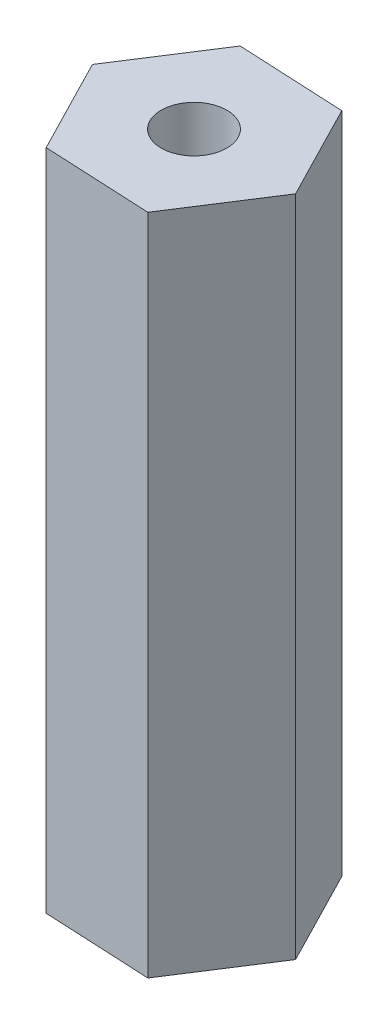
from build123d import *

# Parameters (mm, degrees)
BOSS_EXTRUDE1_DEPTH = 22.20000005
SKETCH2_R           = 1.1
CUT_EXTRUDE1_DEPTH  = 23.710319017


with BuildPart() as part:
    # Sketch1 → Boss-Extrude1 (new body)
    with BuildSketch(Plane(origin=(0, 0, 0), x_dir=(1, 0, 0), z_dir=(0, 1, 0))):
        Polygon((-1.636320259, 3.183675446), (-3.575303943, 0.17474281), (-1.938983684, -3.008932636), (1.636320259, -3.183675446), (3.575303943, -0.17474281), (1.938983684, 3.008932636), align=None)
    extrude(amount=BOSS_EXTRUDE1_DEPTH)

    # Sketch2 → Cut-Extrude1 (cut, through all)
    with BuildSketch(Plane.XZ):
        with Locations(Location((0, 0, 0), (0, 0, 270))):
            Circle(SKETCH2_R)
    extrude(amount=-CUT_EXTRUDE1_DEPTH, mode=Mode.SUBTRACT)


solid = part.part
